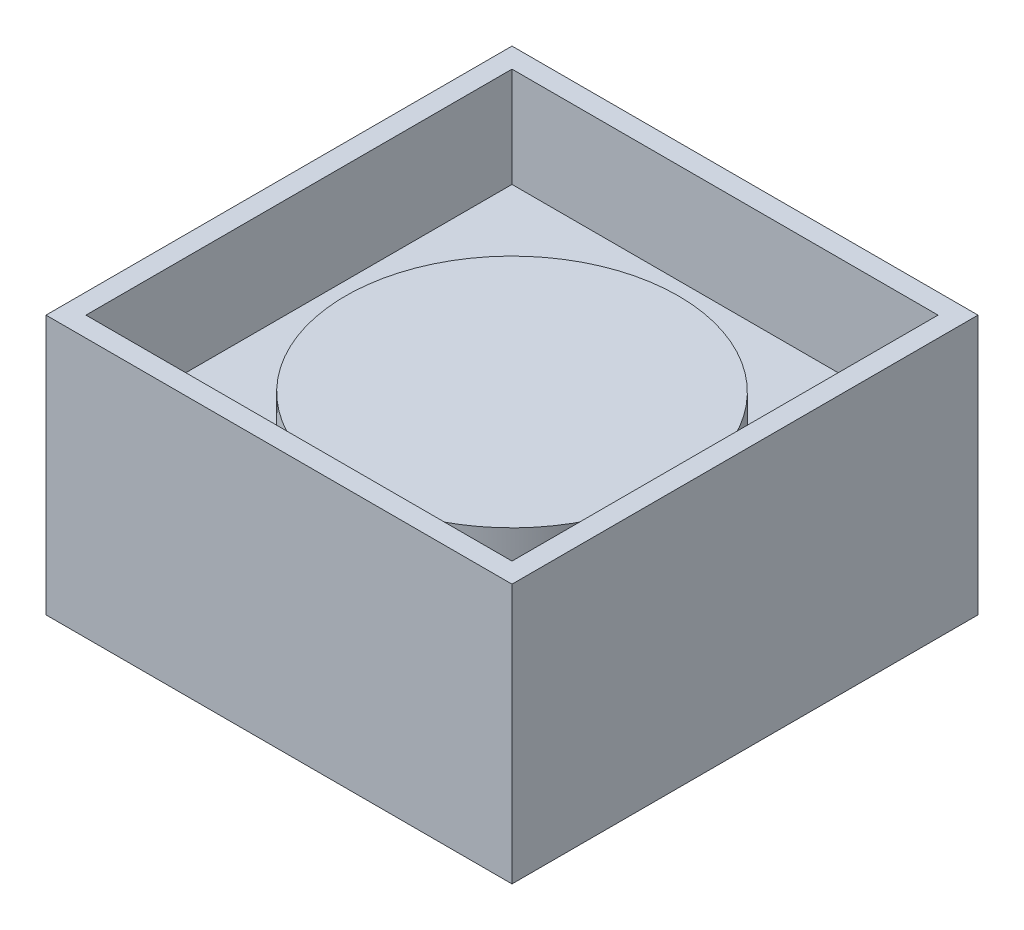
from build123d import *

# Parameters (mm, degrees)
SKETCH1_W           = 70
SKETCH1_H           = 70
BOSS_EXTRUDE1_DEPTH = 39
SKETCH2_W           = 64
SKETCH2_H           = 64
CUT_EXTRUDE1_DEPTH  = 15
SKETCH3_R           = 25
BOSS_EXTRUDE2_DEPTH = 5


with BuildPart() as part:
    # Sketch1 → Boss-Extrude1 (new body)
    with BuildSketch(Plane(origin=(0, 0, 0), x_dir=(1, 0, 0), z_dir=(0, 1, 0))):
        Rectangle(SKETCH1_W, SKETCH1_H)
    extrude(amount=BOSS_EXTRUDE1_DEPTH)

    # Sketch2 → Cut-Extrude1 (cut)
    with BuildSketch(Plane(origin=(0, 39, 0), x_dir=(1, 0, 0), z_dir=(0, 1, 0))):
        Rectangle(SKETCH2_W, SKETCH2_H)
    extrude(amount=-CUT_EXTRUDE1_DEPTH, mode=Mode.SUBTRACT)

    # Sketch3 → Boss-Extrude2 (add)
    with BuildSketch(Plane(origin=(0, 24, 0), x_dir=(1, 0, 0), z_dir=(0, 1, 0))):
        with Locations(Location((0, 0, 0), (0, 0, 90))):
            Circle(SKETCH3_R)
    extrude(amount=BOSS_EXTRUDE2_DEPTH)


solid = part.part
